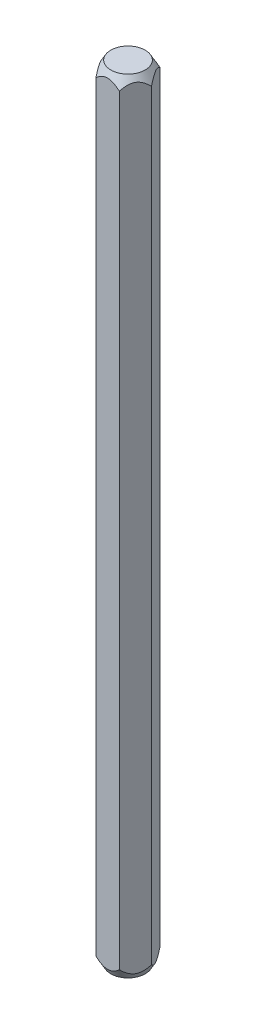
from build123d import *

# Parameters (mm, degrees)
BOSS_EXTRUDE1_DEPTH = 25


with BuildPart() as part:
    # Sketch1 → Boss-Extrude1 (new, symmetric)
    with BuildSketch(Plane(origin=(0, 0, 0), x_dir=(1, 0, 0), z_dir=(0, 1, 0))):
        Polygon((1.5, 0), (0.75, 1.299038106), (-0.75, 1.299038106), (-1.5, 0), (-0.75, -1.299038106), (0.75, -1.299038106), align=None)
    extrude(amount=BOSS_EXTRUDE1_DEPTH, both=True)

    # Sketch2 → Cut-Revolve1 (revolve, cut)
    with BuildSketch(Plane.XY, mode=Mode.PRIVATE) as cut_revolve1_sk:
        Polygon((1.5, 25), (1.5, 24.3), (1.1, 25), align=None)
        Polygon((1.5, -25), (1.5, -24.3), (1.1, -25), align=None)
    revolve(cut_revolve1_sk.sketch.rotate(Axis((0, -25, 0), (0, 1, 0)), 300.000003979), axis=Axis((0, -25, 0), (0, 1, 0)), mode=Mode.SUBTRACT)


solid = part.part
